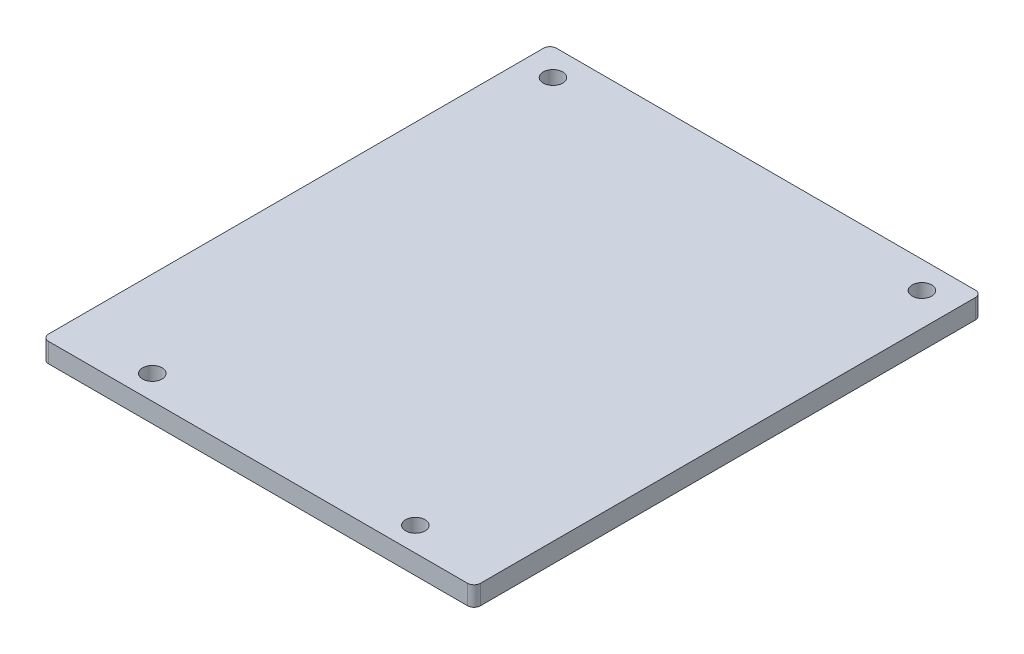
from build123d import *

# Parameters (mm, degrees)
SKETCH1_W           = 66.421
SKETCH1_H           = 78.105
BOSS_EXTRUDE1_DEPTH = 3
SKETCH2_R           = 1.5
CUT_EXTRUDE1_DEPTH  = 3
FILLET1_R           = 1


with BuildPart() as part:
    # Sketch1 → Boss-Extrude1 (new body)
    with BuildSketch(Plane(origin=(0, 0, 0), x_dir=(1, 0, 0), z_dir=(0, 1, 0))):
        with Locations((33.2105, 39.0525)):
            Rectangle(SKETCH1_W, SKETCH1_H)
    extrude(amount=BOSS_EXTRUDE1_DEPTH)

    # Sketch2 → Cut-Extrude1 (cut)
    with BuildSketch(Plane(origin=(0, 3, 0), x_dir=(1, 0, 0), z_dir=(0, 1, 0))):
        with Locations(Location((4.628, 73.936, 0), (0, 0, 270))):
            Circle(SKETCH2_R)
        with Locations(Location((61.376, 73.936, 0), (0, 0, 270))):
            Circle(SKETCH2_R)
        with Locations(Location((13.233, 3.708, 0), (0, 0, 270))):
            Circle(SKETCH2_R)
        with Locations(Location((53.695, 3.708, 0), (0, 0, 270))):
            Circle(SKETCH2_R)
    extrude(amount=-CUT_EXTRUDE1_DEPTH, mode=Mode.SUBTRACT)

    # Fillet1
    fillet1_edges = [part.edges().sort_by_distance(p)[0] for p in [
        (0, 1.5, -78.105),
        (66.421, 1.5, -78.105),
        (66.421, 1.5, 0),
        (0, 1.5, 0),
    ]]
    fillet(fillet1_edges, radius=FILLET1_R)


solid = part.part
